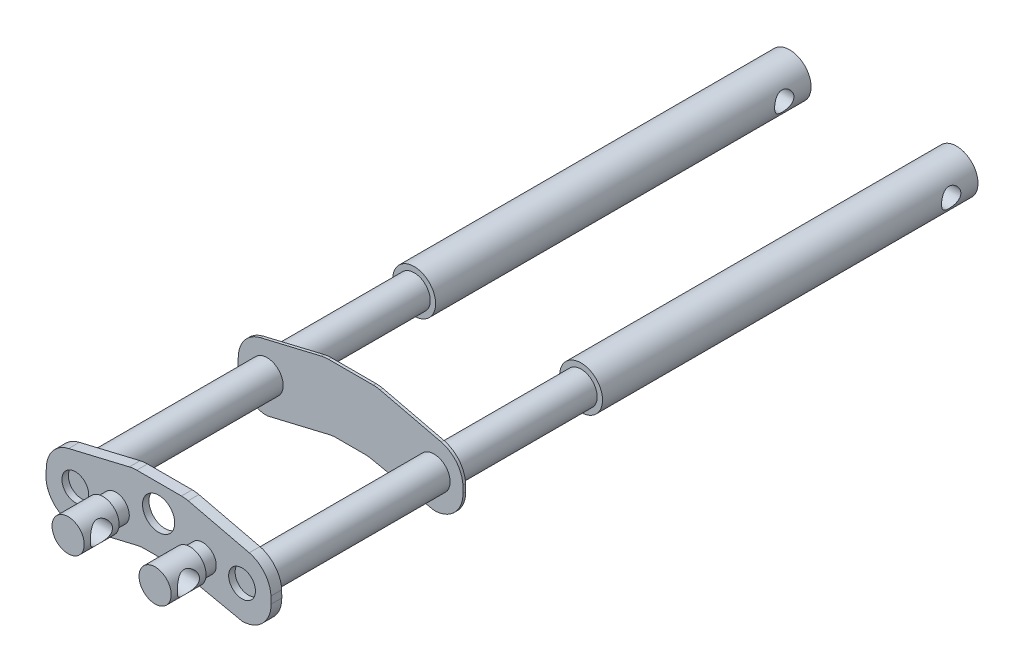
from build123d import *

# Parameters (mm, degrees)
SKETCH1_R           = 12.5
SKETCH1_R_2         = 15
BOSS_EXTRUDE1_DEPTH = 10
CUT_EXTRUDE1_DEPTH  = 4
SKETCH2_R           = 15
BOSS_EXTRUDE2_DEPTH = 310
SKETCH4_R           = 20
BOSS_EXTRUDE3_DEPTH = 350
SKETCH5_R           = 9
CUT_EXTRUDE2_DEPTH  = 130
SKETCH7_R           = 12.5
BOSS_EXTRUDE4_DEPTH = 12
SKETCH8_R           = 15
BOSS_EXTRUDE5_DEPTH = 32.5
CUT_EXTRUDE4_DEPTH  = 17.5
BOSS_EXTRUDE9_DEPTH = 2.54


with BuildPart() as part:
    # Sketch1 → Boss-Extrude1 (new body)
    with BuildSketch(Plane.XY):
        with BuildLine():
            Line((-89.570095219, 21.411879046), (-32.990692592, 34.8582785))
            ThreePointArc((-32.990692592, 34.8582785), (-29.546196229, 35.467277945), (-26.054226792, 35.67120187))
            Line((-26.054226792, 35.67120187), (15.61721004, 35.67120187))
            ThreePointArc((15.61721004, 35.67120187), (18.759982533, 35.487670337), (21.86002926, 34.939570837))
            Line((21.86002926, 34.939570837), (78.781491624, 21.411879046))
            ThreePointArc((78.781491624, 21.411879046), (92.982678112, 12.362761668), (99.059642782, -3.341719329))
            Line((99.059642782, -3.341719329), (99.104791105, -9.970689921))
            ThreePointArc((99.104791105, -9.970689921), (91.262203675, -29.181334574), (72.105417301, -37.154576159))
            Line((72.105417301, -37.154576159), (13.768497366, -24.771120565))
            ThreePointArc((13.768497366, -24.771120565), (10.670890682, -24.28114998), (7.539059211, -24.117229341))
            Line((7.539059211, -24.117229341), (-18.932882818, -24.117229341))
            ThreePointArc((-18.932882818, -24.117229341), (-22.425204467, -24.321194546), (-25.870038642, -24.930316708))
            Line((-25.870038642, -24.930316708), (-83.322313837, -38.585594007))
            ThreePointArc((-83.322313837, -38.585594007), (-103.214288136, -30.264822305), (-110.670897195, -10.033043723))
            Line((-110.670897195, -10.033043723), (-110.28243652, -3.30107316))
            ThreePointArc((-110.28243652, -3.30107316), (-104.020486634, 12.486838294), (-89.570095219, 21.411879046))
        make_face()
        with Locations((-83.327275999, -6.656204625)):
            Circle(SKETCH1_R, mode=Mode.SUBTRACT)
        with Locations((72.096258841, -6.656204625)):
            Circle(SKETCH1_R, mode=Mode.SUBTRACT)
        with Locations((-5.696911803, 10.67120187)):
            Circle(SKETCH1_R_2, mode=Mode.SUBTRACT)
    extrude(amount=BOSS_EXTRUDE1_DEPTH)

    # 3DSketch1 → Cut-Extrude1 (cut)
    with BuildSketch(Plane(origin=(-107.287418684, -3.473897245, 0), x_dir=(0.9994870297629808, -0.032026197644656626, 0), z_dir=(0, 0, -1))):
        with BuildLine():
            Line((0, 0), (-0.172661986, 6.74095818))
            ThreePointArc((-0.172661986, 6.74095818), (6.914077411, 24.390973908), (24.617899659, 31.342204614))
            Line((24.617899659, 31.342204614), (81.275948569, 15.942946864))
            ThreePointArc((81.275948569, 15.942946864), (85.041863702, 15.15189876), (88.87426146, 14.804621763))
            Line((88.87426146, 14.804621763), (115.332624171, 13.956826116))
            ThreePointArc((115.332624171, 13.956826116), (118.781646329, 14.026715605), (122.204526887, 14.456281754))
            Line((122.204526887, 14.456281754), (180.58890898, 24.907932464))
            ThreePointArc((180.58890898, 24.907932464), (197.17977796, 17.178441967), (203.496667101, 0))
            Line((203.496667101, 0), (203.241956569, -6.554252272))
            ThreePointArc((203.241956569, -6.554252272), (197.387923523, -20.283509711), (184.55111532, -27.897875598))
            Line((184.55111532, -27.897875598), (127.251146174, -39.590439494))
            ThreePointArc((127.251146174, -39.590439494), (124.481359474, -39.989137834), (121.68399222, -40.062725686))
            Line((121.68399222, -40.062725686), (80.033931594, -38.728148014))
            ThreePointArc((80.033931594, -38.728148014), (76.898649067, -38.444059574), (73.817746115, -37.796958524))
            Line((73.817746115, -37.796958524), (17.698004084, -22.545433541))
            ThreePointArc((17.698004084, -22.545433541), (5.113876372, -14.204763708), (0, 0))
        make_face()
    extrude(amount=-CUT_EXTRUDE1_DEPTH, mode=Mode.SUBTRACT)

    # Sketch2 → Boss-Extrude2 (add)
    with BuildSketch(Plane(origin=(0, 0, 4), x_dir=(-1, 0, 0), z_dir=(0, 0, -1))):
        with Locations(Location((-72.096258841, -6.656204625, 0), (0, 0, 180))):
            Circle(SKETCH2_R)
        with Locations(Location((83.490082448, -6.656204625, 0), (0, 0, 180))):
            Circle(SKETCH2_R)
    extrude(amount=BOSS_EXTRUDE2_DEPTH)

    # Sketch4 → Boss-Extrude3 (add)
    with BuildSketch(Plane.XY.offset(-306)):
        with Locations((-83.490082448, -6.656204625)):
            Circle(SKETCH4_R)
        with Locations((72.096258841, -6.656204625)):
            Circle(SKETCH4_R)
    extrude(amount=-BOSS_EXTRUDE3_DEPTH)

    # Sketch5 → Cut-Extrude2 (cut, symmetric)
    with BuildSketch(Plane(origin=(0, 0, 0), x_dir=(0, 0, -1), z_dir=(1, 0, 0))):
        with Locations((631, -6.656204625)):
            Circle(SKETCH5_R)
    extrude(amount=CUT_EXTRUDE2_DEPTH, both=True, mode=Mode.SUBTRACT)

    # Sketch7 → Boss-Extrude4 (add)
    with BuildSketch(Plane.XY.offset(10)):
        with Locations(Location((-45.538562342, -4.327517678, 0), (0, 0, 180))):
            Circle(SKETCH7_R)
    boss_extrude4 = extrude(amount=BOSS_EXTRUDE4_DEPTH)

    # Sketch8 → Boss-Extrude5 (add)
    with BuildSketch(Plane.XY.offset(22)):
        with Locations((-45.538562342, -4.327517678)):
            Circle(SKETCH8_R)
    boss_extrude5 = extrude(amount=BOSS_EXTRUDE5_DEPTH)

    # Sketch15 → Cut-Extrude4 (cut, symmetric)
    with BuildSketch(Plane(origin=(-45, 0, 0), x_dir=(0, 0, -1), z_dir=(1, 0, 0))):
        with BuildLine():
            ThreePointArc((-28.151613828, -4.327517678), (-38.5, 6.020868495), (-48.848386172, -4.327517678))
            Line((-48.848386172, -4.327517678), (-28.151613828, -4.327517678))
        make_face()
        with BuildLine():
            Line((-28.151613828, -4.327517678), (-48.848386172, -4.327517678))
            ThreePointArc((-48.848386172, -4.327517678), (-38.5, -14.67590385), (-28.151613828, -4.327517678))
        make_face()
    cut_extrude4 = extrude(amount=CUT_EXTRUDE4_DEPTH, both=True, mode=Mode.SUBTRACT)

    # Mirror5: Boss-Extrude4, Boss-Extrude5, Cut-Extrude4 across plane
    add(boss_extrude4.mirror(Plane(origin=(-5, 0, 0), x_dir=(0, 0, 1), z_dir=(1, 0, 0))))
    add(boss_extrude5.mirror(Plane(origin=(-5, 0, 0), x_dir=(0, 0, 1), z_dir=(1, 0, 0))))
    add(cut_extrude4.mirror(Plane(origin=(-5, 0, 0), x_dir=(0, 0, 1), z_dir=(1, 0, 0))), mode=Mode.SUBTRACT)

    # Sketch29 → Boss-Extrude9 (add)
    with BuildSketch(Plane.XY.offset(-171.45)):
        with BuildLine():
            Line((-83.322313837, -38.585594007), (-25.870038642, -24.930316708))
            ThreePointArc((-25.870038642, -24.930316708), (-22.425204467, -24.321194546), (-18.932882818, -24.117229341))
            Line((-18.932882818, -24.117229341), (7.539059211, -24.117229341))
            ThreePointArc((7.539059211, -24.117229341), (10.670890682, -24.28114998), (13.768497366, -24.771120565))
            Line((13.768497366, -24.771120565), (72.105417301, -37.154576159))
            ThreePointArc((72.105417301, -37.154576159), (91.262203675, -29.181334574), (99.104791105, -9.970689921))
            Line((99.104791105, -9.970689921), (99.059642782, -3.341719329))
            ThreePointArc((99.059642782, -3.341719329), (92.982678112, 12.362761668), (78.781491624, 21.411879046))
            Line((78.781491624, 21.411879046), (21.86002926, 34.939570837))
            ThreePointArc((21.86002926, 34.939570837), (18.759982533, 35.487670337), (15.61721004, 35.67120187))
            Line((15.61721004, 35.67120187), (-26.054226792, 35.67120187))
            ThreePointArc((-26.054226792, 35.67120187), (-29.546196229, 35.467277945), (-32.990692592, 34.8582785))
            Line((-32.990692592, 34.8582785), (-89.570095219, 21.411879046))
            ThreePointArc((-89.570095219, 21.411879046), (-104.020486634, 12.486838294), (-110.28243652, -3.30107316))
            Line((-110.28243652, -3.30107316), (-110.670897195, -10.033043723))
            ThreePointArc((-110.670897195, -10.033043723), (-103.214288136, -30.264822305), (-83.322313837, -38.585594007))
        make_face()
    extrude(amount=BOSS_EXTRUDE9_DEPTH)


solid = part.part
